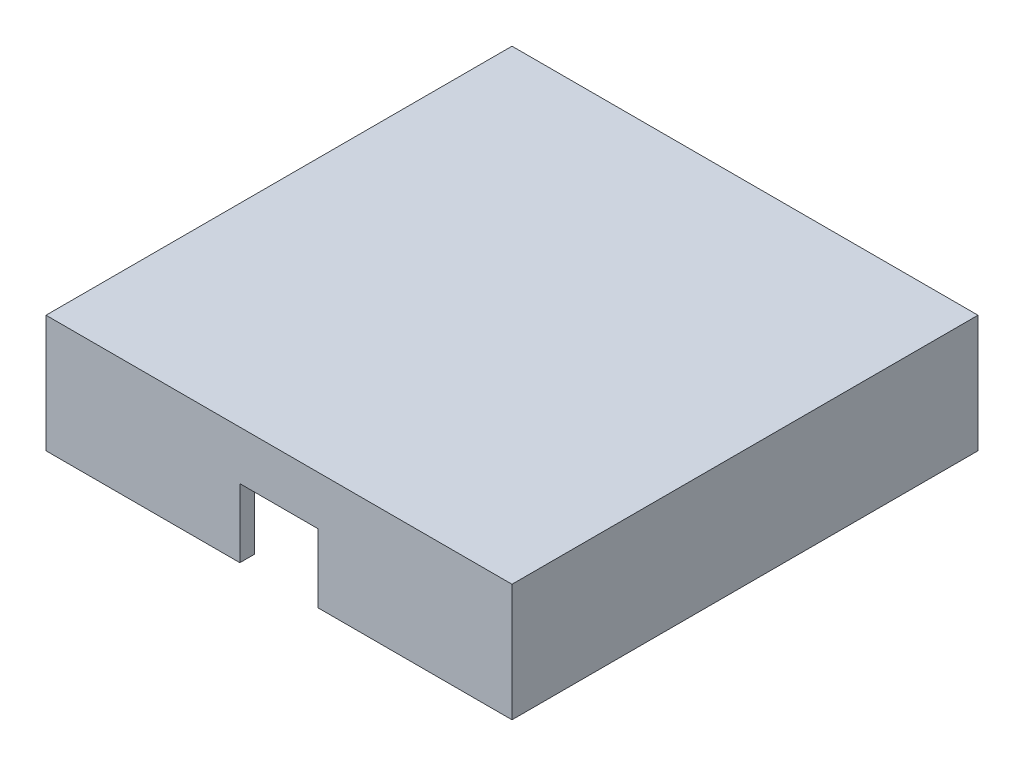
from build123d import *

# Parameters (mm, degrees)
SKETCH1_W           = 47.625
SKETCH1_H           = 47.625
BOSS_EXTRUDE1_DEPTH = 2
BOSS_EXTRUDE2_DEPTH = 4
SKETCH4_R           = 1.5
CUT_EXTRUDE2_DEPTH  = 69.068210275
SKETCH5_W           = 47.625
SKETCH5_H           = 47.625
SKETCH5_W_2         = 44.625
SKETCH5_H_2         = 44.625
BOSS_EXTRUDE3_DEPTH = 10
SKETCH6_W           = 8
SKETCH6_H           = 7
CUT_EXTRUDE3_DEPTH  = 2


with BuildPart() as part:
    # Sketch1 → Boss-Extrude1 (new body)
    with BuildSketch(Plane(origin=(0, 0, 0), x_dir=(1, 0, 0), z_dir=(0, 1, 0))):
        with Locations((23.8125, 23.8125)):
            Rectangle(SKETCH1_W, SKETCH1_H)
    extrude(amount=BOSS_EXTRUDE1_DEPTH)

    # Sketch2 → Boss-Extrude2 (add)
    with BuildSketch(Plane.XZ):
        Polygon((15.680772016, -28.408694078), (28.408694078, -15.680772016), (31.944227984, -19.216305922), (19.216305922, -31.944227984), align=None)
    extrude(amount=BOSS_EXTRUDE2_DEPTH)

    # Sketch4 → Cut-Extrude2 (cut, through all)
    with BuildSketch(Plane(origin=(6.363961031, 0, 6.363961031), x_dir=(0.7071067811865475, 0, -0.7071067811865477), z_dir=(0.7071067811865477, 0, 0.7071067811865475))):
        with Locations(Location((33.675960454, -1.5, 0), (0, 0, 90))):
            Circle(SKETCH4_R)
    extrude(amount=-CUT_EXTRUDE2_DEPTH, mode=Mode.SUBTRACT)

    # Sketch5 → Boss-Extrude3 (add)
    with BuildSketch(Plane.XZ):
        with Locations((23.8125, -23.8125)):
            Rectangle(SKETCH5_W, SKETCH5_H)
        with Locations((23.8125, -23.8125)):
            Rectangle(SKETCH5_W_2, SKETCH5_H_2, mode=Mode.SUBTRACT)
    extrude(amount=BOSS_EXTRUDE3_DEPTH)

    # Sketch6 → Cut-Extrude3 (cut)
    with BuildSketch(Plane.XY):
        with Locations((23.8125, -6.5)):
            Rectangle(SKETCH6_W, SKETCH6_H)
    extrude(amount=-CUT_EXTRUDE3_DEPTH, mode=Mode.SUBTRACT)


solid = part.part
